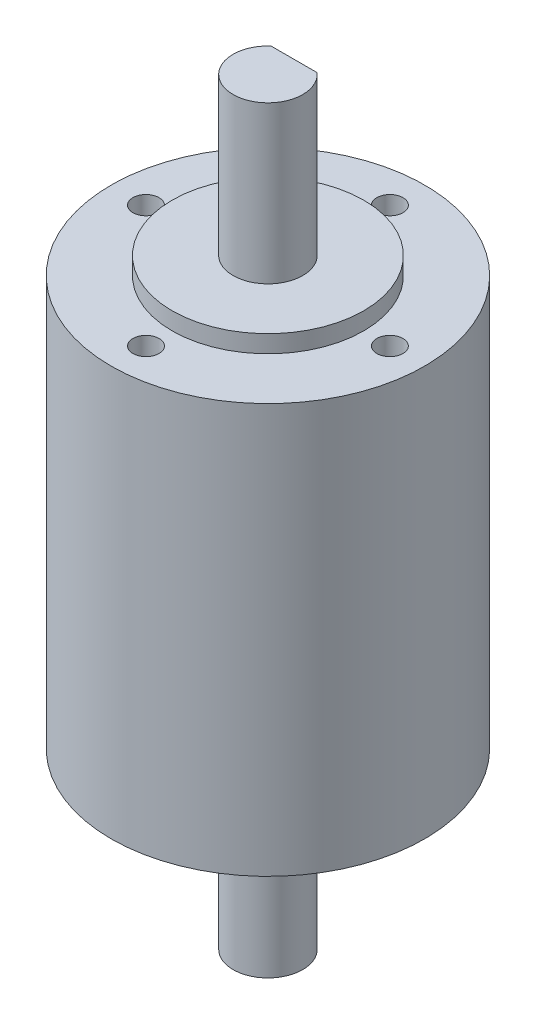
from build123d import *

# Parameters (mm, degrees)
SKETCH_1_R          = 18
EXTRUDE_1_DEPTH     = 47
SKETCH_2_R          = 11
EXTRUDE_2_DEPTH     = 2
EXTRUDE_START       = 2
SKETCH_3_R          = 11
EXTRUDE_3_DEPTH     = 2
SKETCH_4_R          = 4
EXTRUDE_4_DEPTH     = 18
EXTRUDE_START_2     = 18
SKETCH_5_R          = 4
EXTRUDE_5_DEPTH     = 18
SKETCH_6_W          = 9.252434457
SKETCH_6_H          = 4.602247191
CUT_EXTRUDE_1_DEPTH = 15
SKETCH_7_W          = 9.252434457
SKETCH_7_H          = 4.602247191
CUT_EXTRUDE_2_DEPTH = 15
SKETCH_8_R          = 1.5
CUT_EXTRUDE_3_DEPTH = 6
CUT_EXTRUDE_START   = -6
SKETCH_9_R          = 1.5
CUT_EXTRUDE_4_DEPTH = 6


with BuildPart() as part:
    # 草图1 → 凸台-拉伸1 (new body)
    with BuildSketch(Plane(origin=(0, 0, 0), x_dir=(1, 0, 0), z_dir=(0, 1, 0))):
        with Locations(Location((0, 0, 0), (0, 0, 270))):
            Circle(SKETCH_1_R)
    extrude(amount=EXTRUDE_1_DEPTH)

    # 草图2 → 凸台-拉伸2 (add)
    with BuildSketch(Plane(origin=(0, 47, 0), x_dir=(1, 0, 0), z_dir=(0, 1, 0))):
        with Locations(Location((0, 0, 0), (0, 0, 270))):
            Circle(SKETCH_2_R)
    extrude(amount=EXTRUDE_2_DEPTH)

    # 草图3 → 凸台-拉伸3 (add)
    with BuildSketch(Plane.XZ.offset(EXTRUDE_START)):
        with Locations(Location((0, 0, 0), (0, 0, 90))):
            Circle(SKETCH_3_R)
    extrude(amount=-EXTRUDE_3_DEPTH)

    # 草图4 → 凸台-拉伸4 (add)
    with BuildSketch(Plane.XZ.offset(2)):
        with Locations(Location((0, 0, 0), (0, 0, 270))):
            Circle(SKETCH_4_R)
    extrude(amount=EXTRUDE_4_DEPTH)

    # 草图5 → 凸台-拉伸5 (add)
    with BuildSketch(Plane(origin=(0, 49, 0), x_dir=(1, 0, 0), z_dir=(0, 1, 0)).offset(EXTRUDE_START_2)):
        with Locations(Location((0, 0, 0), (0, 0, 90))):
            Circle(SKETCH_5_R)
    extrude(amount=-EXTRUDE_5_DEPTH)

    # 草图6 → 切除-拉伸1 (cut)
    with BuildSketch(Plane(origin=(0, 67, 0), x_dir=(1, 0, 0), z_dir=(0, 1, 0))):
        with Locations((-0.167790263, 5.301123596)):
            Rectangle(SKETCH_6_W, SKETCH_6_H)
    extrude(amount=-CUT_EXTRUDE_1_DEPTH, mode=Mode.SUBTRACT)

    # 草图7 → 切除-拉伸2 (cut)
    with BuildSketch(Plane.XZ.offset(20)):
        with Locations((-0.167790263, -5.301123596)):
            Rectangle(SKETCH_7_W, SKETCH_7_H)
    extrude(amount=-CUT_EXTRUDE_2_DEPTH, mode=Mode.SUBTRACT)

    # 草图8 → 切除-拉伸3 (cut)
    with BuildSketch(Plane.XZ):
        with Locations(Location((0, 14, 0), (0, 0, 270))):
            Circle(SKETCH_8_R)
        with Locations(Location((14, 0, 0), (0, 0, 270))):
            Circle(SKETCH_8_R)
        with Locations(Location((0, -14, 0), (0, 0, 270))):
            Circle(SKETCH_8_R)
        with Locations(Location((-14, 0, 0), (0, 0, 270))):
            Circle(SKETCH_8_R)
    extrude(amount=-CUT_EXTRUDE_3_DEPTH, mode=Mode.SUBTRACT)

    # 草图9 → 切除-拉伸4 (cut)
    with BuildSketch(Plane(origin=(0, 47, 0), x_dir=(1, 0, 0), z_dir=(0, 1, 0)).offset(CUT_EXTRUDE_START)):
        with Locations(Location((-14, 0, 0), (0, 0, 90))):
            Circle(SKETCH_9_R)
        with Locations(Location((0, 14, 0), (0, 0, 90))):
            Circle(SKETCH_9_R)
        with Locations(Location((14, 0, 0), (0, 0, 90))):
            Circle(SKETCH_9_R)
        with Locations(Location((0, -14, 0), (0, 0, 90))):
            Circle(SKETCH_9_R)
    extrude(amount=CUT_EXTRUDE_4_DEPTH, mode=Mode.SUBTRACT)


solid = part.part
